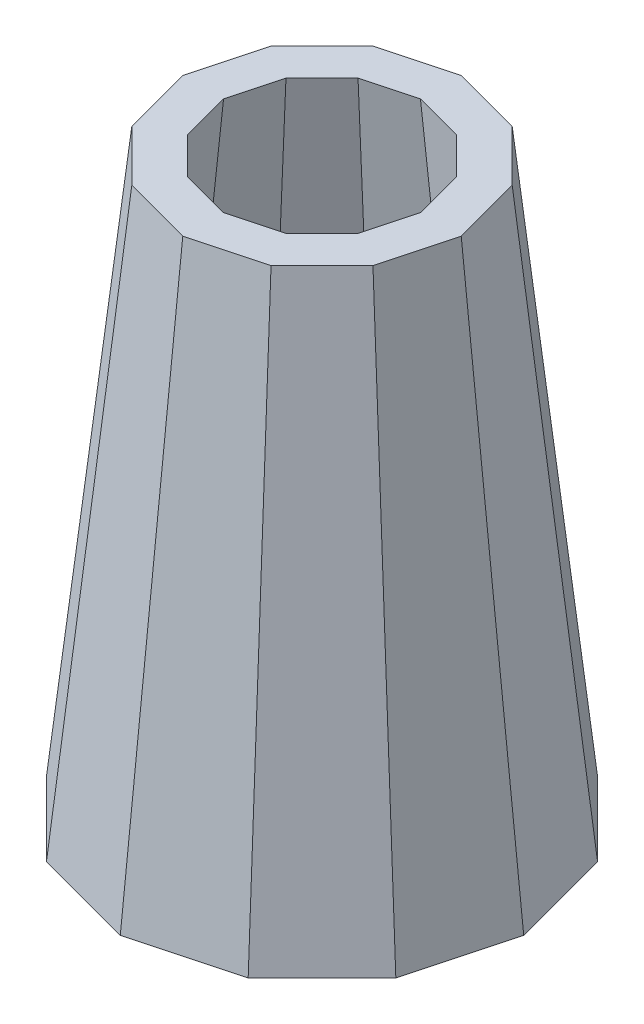
from build123d import *

# Parameters (mm, degrees)
BOSS_EXTRUDE1_DEPTH = 279.4
BOSS_EXTRUDE1_TAPER = 6
SHELL1_T            = -19.05


with BuildPart() as part:
    # Sketch1 → Boss-Extrude1 (new body)
    with BuildSketch(Plane(origin=(0, 0, 0), x_dir=(1, 0, 0), z_dir=(0, 1, 0))):
        Polygon((98.138063951, 0), (84.99005646, 49.069031975), (49.069031975, 84.99005646), (0, 98.138063951), (-49.069031975, 84.99005646), (-84.99005646, 49.069031975), (-98.138063951, 0), (-84.99005646, -49.069031975), (-49.069031975, -84.99005646), (0, -98.138063951), (49.069031975, -84.99005646), (84.99005646, -49.069031975), align=None)
    extrude(amount=BOSS_EXTRUDE1_DEPTH, taper=BOSS_EXTRUDE1_TAPER)

    # Shell1
    shell1_openings = [part.faces().sort_by_distance(p)[0] for p in [
        (0, 279.4, 0),
        (0, 0, 0),
    ]]
    offset(amount=SHELL1_T, openings=shell1_openings, kind=Kind.INTERSECTION)


solid = part.part
